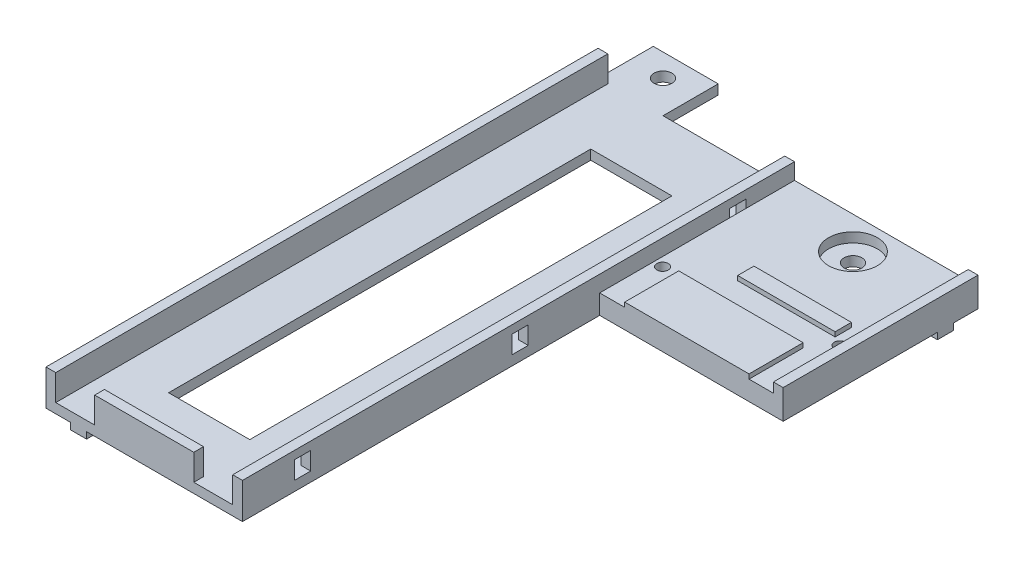
from build123d import *

# Parameters (mm, degrees)
SKETCH1_W               = 60.5
SKETCH1_H               = 170
BOSS_EXTRUDE1_DEPTH     = 11
SKETCH2_W               = 54.5
SKETCH2_H               = 167
CUT_EXTRUDE1_DEPTH      = 8
SKETCH3_W               = 12
SKETCH3_H               = 3
CUT_EXTRUDE2_DEPTH      = 8
SKETCH4_W               = 20
SKETCH4_H               = 20
SKETCH4_R               = 2.75
BOSS_EXTRUDE3_DEPTH     = 3
SKETCH5_W               = 5
SKETCH5_H               = 5.5
CUT_EXTRUDE3_DEPTH      = 16
SKETCH7_W               = 56.5
SKETCH7_H               = 60
SKETCH7_R               = 1.75
BOSS_EXTRUDE7_DEPTH     = 3
SKETCH9_W               = 38.3
SKETCH9_H               = 16.65
SKETCH9_W_2             = 30
SKETCH9_H_2             = 5
BOSS_EXTRUDE8_DEPTH     = 1.4
SKETCH10_W              = 3
SKETCH10_H              = 60
BOSS_EXTRUDE9_DEPTH     = 6
SKETCH12_R              = 2.75
CUT_EXTRUDE4_DEPTH      = 3
SKETCH13_W              = 20.5
SKETCH13_H              = 5
SKETCH13_W_2            = 30
SKETCH13_W_3            = 5
SKETCH13_H_2            = 172
BOSS_EXTRUDE10_DEPTH    = 2
SKETCH14_W              = 38.3
SKETCH14_H              = 16.65
SKETCH14_W_2            = 30
SKETCH14_H_2            = 5
BOSS_EXTRUDE11_DEPTH    = 3
SKETCH15_W              = 53.5
SKETCH15_H              = 60
SKETCH15_R              = 1.75
SKETCH15_R_2            = 2.75
BOSS_EXTRUDE12_DEPTH    = 3
SKETCH16_R              = 1.75
CUT_EXTRUDE5_DEPTH      = 3
CUT_EXTRUDE6_START      = -3
SKETCH17_R              = 7.5
SKETCH17_R_2            = 2.75
CUT_EXTRUDE6_DEPTH      = 3
SKETCH18_W              = 20
SKETCH18_H              = 3
CUT_EXTRUDE7_DEPTH      = 3
CUT_EXTRUDE8_DEPTH      = 135.140085359
CUT_EXTRUDE8_DEPTH_BACK = 135.140085359
SKETCH19_W              = 25
SKETCH19_H              = 130


with BuildPart() as part:
    # Sketch1 → Boss-Extrude1 (new body)
    with BuildSketch(Plane(origin=(0, 0, 0), x_dir=(1, 0, 0), z_dir=(0, 1, 0))):
        Rectangle(SKETCH1_W, SKETCH1_H)
    extrude(amount=BOSS_EXTRUDE1_DEPTH)

    # Sketch2 → Cut-Extrude1 (cut)
    with BuildSketch(Plane(origin=(0, 11, 0), x_dir=(1, 0, 0), z_dir=(0, 1, 0))):
        with Locations((0, 1.5)):
            Rectangle(SKETCH2_W, SKETCH2_H)
    extrude(amount=-CUT_EXTRUDE1_DEPTH, mode=Mode.SUBTRACT)

    # Sketch3 → Cut-Extrude2 (cut)
    with BuildSketch(Plane(origin=(0, 11, 0), x_dir=(1, 0, 0), z_dir=(0, 1, 0))):
        with Locations((-21.25, -83.5)):
            Rectangle(SKETCH3_W, SKETCH3_H)
        with Locations((21.25, -83.5)):
            Rectangle(SKETCH3_W, SKETCH3_H)
    extrude(amount=-CUT_EXTRUDE2_DEPTH, mode=Mode.SUBTRACT)

    # Sketch4 → Boss-Extrude3 (add)
    with BuildSketch(Plane.XZ):
        with Locations((-20.25, -95)):
            Rectangle(SKETCH4_W, SKETCH4_H)
        with Locations(Location((-20.25, -95, 0), (0, 0, 270))):
            Circle(SKETCH4_R, mode=Mode.SUBTRACT)
    extrude(amount=-BOSS_EXTRUDE3_DEPTH)

    # Sketch5 → Cut-Extrude3 (cut)
    with BuildSketch(Plane.ZY.offset(-27.25)):
        with Locations((66.5, 5.75)):
            Rectangle(SKETCH5_W, SKETCH5_H)
        with Locations((-0.5, 5.75)):
            Rectangle(SKETCH5_W, SKETCH5_H)
        with Locations((-67.5, 5.75)):
            Rectangle(SKETCH5_W, SKETCH5_H)
    extrude(amount=-CUT_EXTRUDE3_DEPTH, mode=Mode.SUBTRACT)

    # Sketch7 → Boss-Extrude7 (add)
    with BuildSketch(Plane.XZ):
        with Locations((58.5, -55)):
            Rectangle(SKETCH7_W, SKETCH7_H)
        with Locations(Location((81.25, -48, 0), (0, 0, 270))):
            Circle(SKETCH7_R, mode=Mode.SUBTRACT)
        with Locations(Location((32.95, -41.65, 0), (0, 0, 270))):
            Circle(SKETCH7_R, mode=Mode.SUBTRACT)
    extrude(amount=-BOSS_EXTRUDE7_DEPTH)

    # Sketch9 → Boss-Extrude8 (add)
    with BuildSketch(Plane(origin=(0, 3, 0), x_dir=(1, 0, 0), z_dir=(0, 1, 0))):
        with Locations((57.1, 33.325)):
            Rectangle(SKETCH9_W, SKETCH9_H)
        with Locations((63.25, 52)):
            Rectangle(SKETCH9_W_2, SKETCH9_H_2)
    extrude(amount=BOSS_EXTRUDE8_DEPTH)

    # Sketch10 → Boss-Extrude9 (add)
    with BuildSketch(Plane(origin=(0, 3, 0), x_dir=(1, 0, 0), z_dir=(0, 1, 0))):
        with Locations((85.25, 55)):
            Rectangle(SKETCH10_W, SKETCH10_H)
    extrude(amount=BOSS_EXTRUDE9_DEPTH)

    # Sketch12 → Cut-Extrude4 (cut)
    with BuildSketch(Plane(origin=(0, 3, 0), x_dir=(1, 0, 0), z_dir=(0, 1, 0))):
        with Locations(Location((58.25, 75, 0), (0, 0, 270))):
            Circle(SKETCH12_R)
    extrude(amount=-CUT_EXTRUDE4_DEPTH, mode=Mode.SUBTRACT)

    # Sketch13 → Boss-Extrude10 (add)
    with BuildSketch(Plane.XZ):
        with Locations((76.5, -75)):
            Rectangle(SKETCH13_W, SKETCH13_H)
        with Locations((35.25, -75)):
            Rectangle(SKETCH13_W_2, SKETCH13_H)
        with Locations((-20.25, -1)):
            Rectangle(SKETCH13_W_3, SKETCH13_H_2)
    extrude(amount=BOSS_EXTRUDE10_DEPTH)

    # Sketch14 → Boss-Extrude11 (add)
    with BuildSketch(Plane(origin=(0, 4.4, 0), x_dir=(1, 0, 0), z_dir=(0, 1, 0))):
        with Locations((57.1, 33.325)):
            Rectangle(SKETCH14_W, SKETCH14_H)
        with Locations((63.25, 52)):
            Rectangle(SKETCH14_W_2, SKETCH14_H_2)
    extrude(amount=BOSS_EXTRUDE11_DEPTH)

    # Sketch15 → Boss-Extrude12 (add)
    with BuildSketch(Plane(origin=(0, 3, 0), x_dir=(1, 0, 0), z_dir=(0, 1, 0))):
        with Locations((57, 55)):
            Rectangle(SKETCH15_W, SKETCH15_H)
        with Locations(Location((32.95, 41.65, 0), (0, 0, 90))):
            Circle(SKETCH15_R, mode=Mode.SUBTRACT)
        with Locations(Location((81.25, 48, 0), (0, 0, 90))):
            Circle(SKETCH15_R, mode=Mode.SUBTRACT)
        with Locations(Location((58.25, 75, 0), (0, 0, 270))):
            Circle(SKETCH15_R_2, mode=Mode.SUBTRACT)
    extrude(amount=BOSS_EXTRUDE12_DEPTH)

    # Sketch16 → Cut-Extrude5 (cut)
    # profile 1 of 2: a face of its own
    with BuildSketch(Plane.XZ):
        Polygon((81.25, -44.824573519), (78.5, -46.41228676), (78.5, -49.58771324), (81.25, -51.175426481), (84, -49.58771324), (84, -46.41228676), align=None)
        with Locations(Location((81.25, -48, 0), (0, 0, 270))):
            Circle(SKETCH16_R, mode=Mode.SUBTRACT)
    # profile 2 of 2: a face of its own
    with BuildSketch(Plane.XZ):
        Polygon((32.95, -38.474573519), (30.2, -40.06228676), (30.2, -43.23771324), (32.95, -44.825426481), (35.7, -43.23771324), (35.7, -40.06228676), align=None)
        with Locations(Location((32.95, -41.65, 0), (0, 0, 270))):
            Circle(SKETCH16_R, mode=Mode.SUBTRACT)
    extrude(amount=-CUT_EXTRUDE5_DEPTH, mode=Mode.SUBTRACT)

    # Sketch17 → Cut-Extrude6 (cut)
    with BuildSketch(Plane(origin=(0, 6, 0), x_dir=(1, 0, 0), z_dir=(0, 1, 0)).offset(CUT_EXTRUDE6_START)):
        with Locations(Location((58.25, 75, 0), (0, 0, 270))):
            Circle(SKETCH17_R)
        with Locations(Location((58.25, 75, 0), (0, 0, 270))):
            Circle(SKETCH17_R_2, mode=Mode.SUBTRACT)
    extrude(amount=CUT_EXTRUDE6_DEPTH, mode=Mode.SUBTRACT)

    # Sketch18 → Cut-Extrude7 (cut)
    with BuildSketch(Plane(origin=(0, 0, -105), x_dir=(-1, 0, 0), z_dir=(0, 0, -1))):
        with Locations((20.25, 1.5)):
            Rectangle(SKETCH18_W, SKETCH18_H)
    extrude(amount=-CUT_EXTRUDE7_DEPTH, mode=Mode.SUBTRACT)

    # Sketch19 → Cut-Extrude8 (cut, two sides: drawn at the far end of the back side and taken through both)
    with BuildSketch(Plane(origin=(0, 3, 0), x_dir=(1, 0, 0), z_dir=(0, 1, 0)).offset(-CUT_EXTRUDE8_DEPTH_BACK)):
        Rectangle(SKETCH19_W, SKETCH19_H)
    extrude(amount=CUT_EXTRUDE8_DEPTH + CUT_EXTRUDE8_DEPTH_BACK, mode=Mode.SUBTRACT)


solid = part.part
